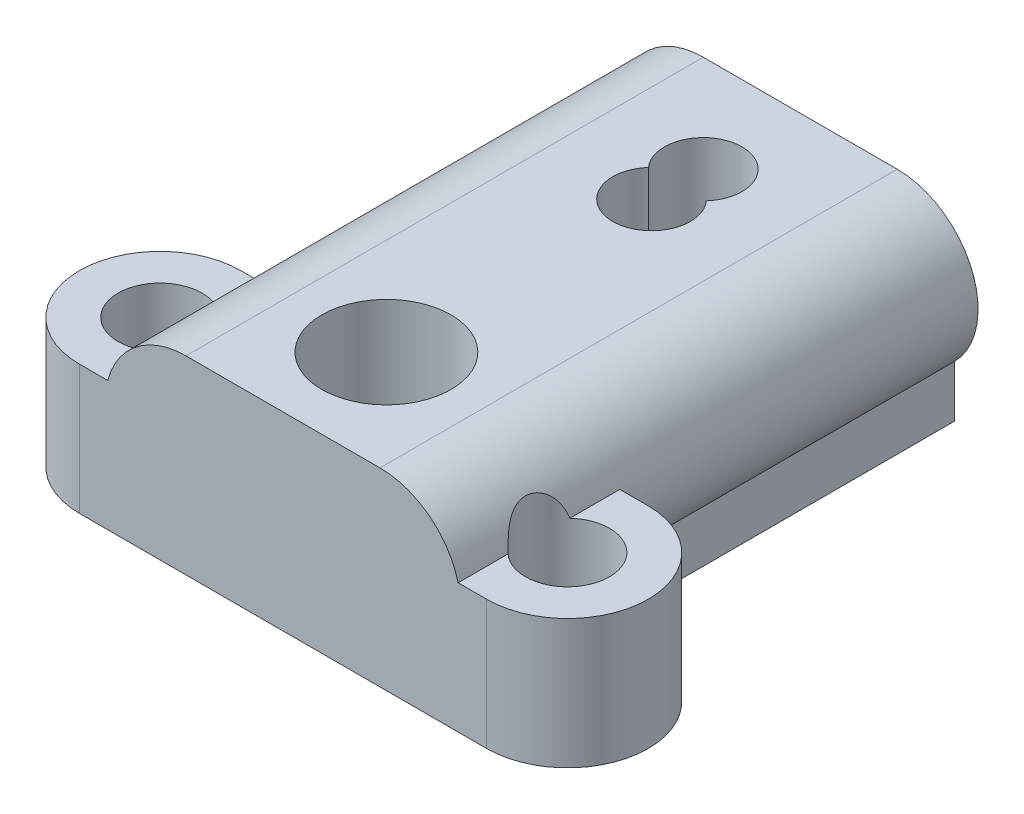
from build123d import *

# Parameters (mm, degrees)
SKETCH1_R               = 3.25
BOSS_EXTRUDE1_DEPTH     = 40
BOSS_EXTRUDE2_START     = -30
SKETCH10_R              = 3.25
BOSS_EXTRUDE2_DEPTH     = 30
SKETCH2_R               = 3
SKETCH2_R_2             = 5
CUT_EXTRUDE1_DEPTH      = 10.669417382
SKETCH8_R               = 1.6
SKETCH8_R_2             = 2.6
CUT_EXTRUDE2_DEPTH      = 45.768898873
SKETCH11_R              = 3.25
BOSS_EXTRUDE3_DEPTH     = 10
CUT_EXTRUDE3_DEPTH      = 48.949888605
CUT_EXTRUDE3_DEPTH_BACK = 48.949888605
SKETCH12_R              = 3.25
SKETCH13_R              = 3.25
BOSS_EXTRUDE4_DEPTH     = 2


with BuildPart() as part:
    # Sketch1 → Boss-Extrude1 (new body)
    with BuildSketch(Plane.XY):
        with BuildLine():
            Line((-11.919417382, 0), (11.919417382, 0))
            Line((11.919417382, 0), (11.919417382, 4))
            ThreePointArc((11.919417382, 4), (13.274247078, 10.811188835), (7.5, 14.669417382))
            Line((7.5, 14.669417382), (-7.5, 14.669417382))
            ThreePointArc((-7.5, 14.669417382), (-13.274247078, 10.811188835), (-11.919417382, 4))
            Line((-11.919417382, 4), (-11.919417382, 0))
        make_face()
        with Locations((7.5, 8.419417382)):
            Circle(SKETCH1_R, mode=Mode.SUBTRACT)
        with Locations((-7.5, 8.419417382)):
            Circle(SKETCH1_R, mode=Mode.SUBTRACT)
    extrude(amount=BOSS_EXTRUDE1_DEPTH)

    # Sketch10 → Boss-Extrude2 (add)
    with BuildSketch(Plane.XY.offset(40).offset(BOSS_EXTRUDE2_START)):
        with Locations((7.5, 8.419417382)):
            Circle(SKETCH10_R)
        with Locations((-7.5, 8.419417382)):
            Circle(SKETCH10_R)
    extrude(amount=BOSS_EXTRUDE2_DEPTH)

    # Sketch2 → Cut-Extrude1 (cut)
    with BuildSketch(Plane(origin=(0, 14.669417382, 0), x_dir=(1, 0, 0), z_dir=(0, 1, 0))):
        with Locations((0, -7.5)):
            Circle(SKETCH2_R)
        with Locations((0, -11.5)):
            Circle(SKETCH2_R)
        with Locations(Location((0, -32, 0), (0, 0, 180))):
            Circle(SKETCH2_R_2)
    extrude(amount=-CUT_EXTRUDE1_DEPTH, mode=Mode.SUBTRACT)

    # Sketch8 → Cut-Extrude2 (cut, through all)
    with BuildSketch(Plane(origin=(0, 14.669417382, 0), x_dir=(1, 0, 0), z_dir=(0, 1, 0))):
        with Locations(Location((0, -7.5, 0), (0, 0, 180))):
            Circle(SKETCH8_R)
        with Locations(Location((0, -11.5, 0), (0, 0, 180))):
            Circle(SKETCH8_R)
        with Locations(Location((0, -32, 0), (0, 0, 180))):
            Circle(SKETCH8_R_2)
    extrude(amount=-CUT_EXTRUDE2_DEPTH, mode=Mode.SUBTRACT)

    # Sketch11 → Boss-Extrude3 (add)
    # profile 1 of 2: a face of its own
    with BuildSketch(Plane.XZ):
        with BuildLine():
            Line((-15.75, 27.5), (-11.919417382, 27.5))
            Line((-11.919417382, 27.5), (-11.919417382, 40))
            Line((-11.919417382, 40), (-15.75, 40))
            ThreePointArc((-15.75, 40), (-22, 33.75), (-15.75, 27.5))
        make_face()
        with Locations(Location((-15.75, 33.75, 0), (0, 0, 270))):
            Circle(SKETCH11_R, mode=Mode.SUBTRACT)
    # profile 2 of 2: a face of its own
    with BuildSketch(Plane.XZ):
        with BuildLine():
            Line((15.75, 40), (11.919417382, 40))
            Line((11.919417382, 40), (11.919417382, 27.5))
            Line((11.919417382, 27.5), (15.75, 27.5))
            ThreePointArc((15.75, 27.5), (22, 33.75), (15.75, 40))
        make_face()
        with Locations(Location((15.75, 33.75, 0), (0, 0, 270))):
            Circle(SKETCH11_R, mode=Mode.SUBTRACT)
    extrude(amount=-BOSS_EXTRUDE3_DEPTH)

    # Sketch12 → Cut-Extrude3 (cut, two sides: drawn at the far end of the back side and taken through both)
    with BuildSketch(Plane.XZ.offset(-CUT_EXTRUDE3_DEPTH_BACK)):
        with Locations(Location((15.75, 33.75, 0), (0, 0, 270))):
            Circle(SKETCH12_R)
        with Locations(Location((-15.75, 33.75, 0), (0, 0, 270))):
            Circle(SKETCH12_R)
    extrude(amount=CUT_EXTRUDE3_DEPTH + CUT_EXTRUDE3_DEPTH_BACK, mode=Mode.SUBTRACT)

    # Sketch13 → Boss-Extrude4 (add)
    with BuildSketch(Plane.XZ):
        with Locations(Location((15.75, 33.75, 0), (0, 0, 270))):
            Circle(SKETCH13_R)
        with Locations(Location((-15.75, 33.75, 0), (0, 0, 270))):
            Circle(SKETCH13_R)
    extrude(amount=-BOSS_EXTRUDE4_DEPTH)


solid = part.part
